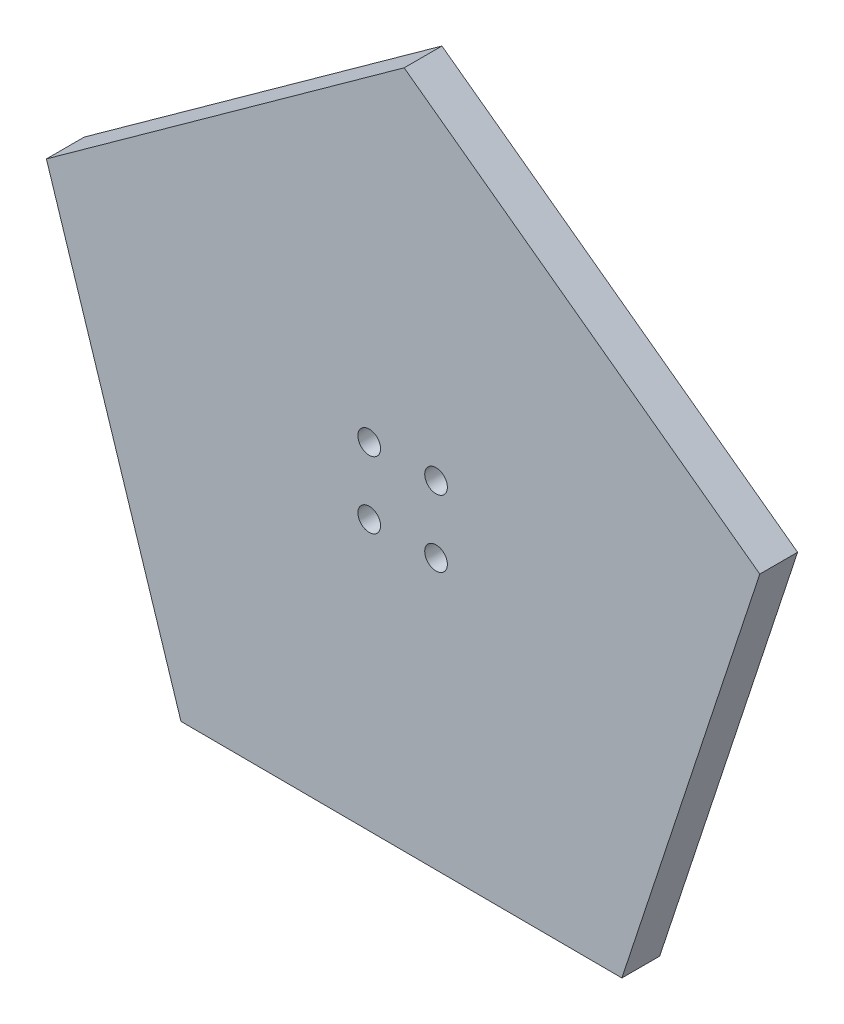
from build123d import *

# Parameters (mm, degrees)
BOSS_EXTRUDE1_DEPTH = 3
SKETCH2_R           = 0.9
CUT_EXTRUDE1_DEPTH  = 3


with BuildPart() as part:
    # Sketch1 → Boss-Extrude1 (new body)
    with BuildSketch(Plane.XY):
        Polygon((-17.596228945, -24.016474641), (17.403490925, -24.156507009), (28.352177859, 9.08693226), (0.119118647, 29.772539999), (-28.278558486, 9.313509391), align=None)
    extrude(amount=BOSS_EXTRUDE1_DEPTH)

    # Sketch2 → Cut-Extrude1 (cut)
    with BuildSketch(Plane(origin=(0, 0, 0), x_dir=(-1, 0, 0), z_dir=(0, 0, -1))):
        with Locations((2.651650429, -2.651650429)):
            Circle(SKETCH2_R)
        with Locations((-2.651650429, -2.651650429)):
            Circle(SKETCH2_R)
        with Locations((-2.651650429, 2.651650429)):
            Circle(SKETCH2_R)
        with Locations((2.651650429, 2.651650429)):
            Circle(SKETCH2_R)
    extrude(amount=-CUT_EXTRUDE1_DEPTH, mode=Mode.SUBTRACT)


solid = part.part
